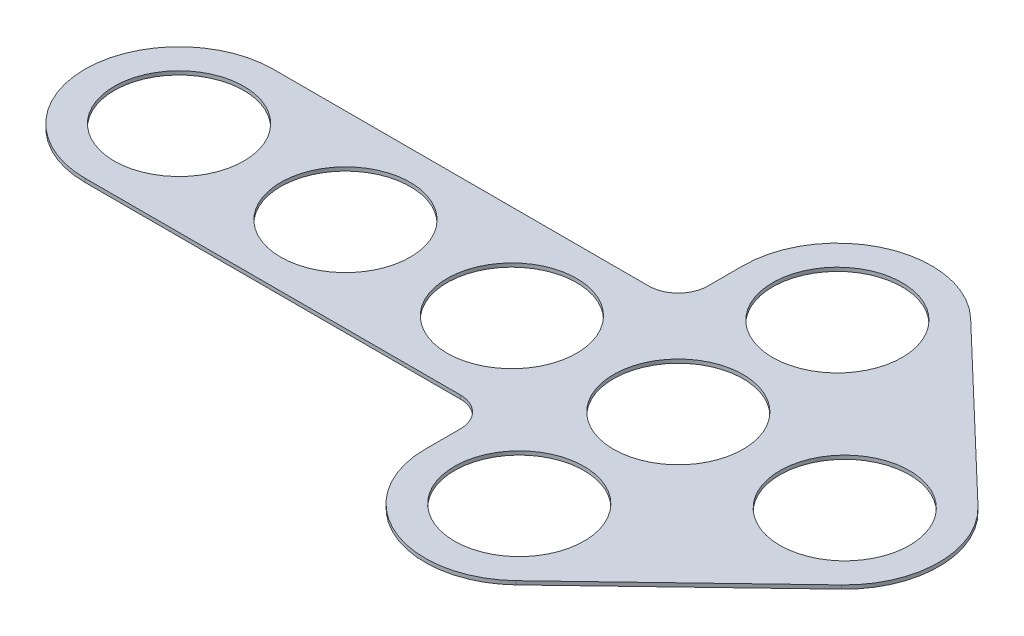
from build123d import *

# Parameters (mm, degrees)
SKETCH1_R           = 55.88
BOSS_EXTRUDE1_DEPTH = 3.175
FILLET1_R           = 25.4


with BuildPart() as part:
    # Sketch1 → Boss-Extrude1 (new body)
    with BuildSketch(Plane(origin=(0, 0, 0), x_dir=(1, 0, 0), z_dir=(0, 1, 0))):
        with BuildLine():
            Line((87.63, 309.88), (436.88, 309.88))
            Line((436.88, 309.88), (436.88, 365.76))
            ThreePointArc((436.88, 365.76), (486.208175566, 440.496331963), (574.318959531, 424.518911361))
            Line((574.318959531, 424.518911361), (717.828959531, 287.358911361))
            ThreePointArc((717.828959531, 287.358911361), (742.95, 228.6), (717.828959531, 169.841088639))
            Line((717.828959531, 169.841088639), (574.318959531, 32.681088639))
            ThreePointArc((574.318959531, 32.681088639), (486.208175566, 16.703668037), (436.88, 91.44))
            Line((436.88, 91.44), (436.88, 147.32))
            Line((436.88, 147.32), (87.63, 147.32))
            ThreePointArc((87.63, 147.32), (6.35, 228.6), (87.63, 309.88))
        make_face()
        with Locations(Location((87.63, 228.6, 0), (0, 0, 270))):
            Circle(SKETCH1_R, mode=Mode.SUBTRACT)
        with Locations(Location((231.14, 228.6, 0), (0, 0, 270))):
            Circle(SKETCH1_R, mode=Mode.SUBTRACT)
        with Locations(Location((374.65, 228.6, 0), (0, 0, 270))):
            Circle(SKETCH1_R, mode=Mode.SUBTRACT)
        with Locations(Location((518.16, 228.6, 0), (0, 0, 270))):
            Circle(SKETCH1_R, mode=Mode.SUBTRACT)
        with Locations(Location((661.67, 228.6, 0), (0, 0, 270))):
            Circle(SKETCH1_R, mode=Mode.SUBTRACT)
        with Locations(Location((518.16, 365.76, 0), (0, 0, 270))):
            Circle(SKETCH1_R, mode=Mode.SUBTRACT)
        with Locations(Location((518.16, 91.44, 0), (0, 0, 270))):
            Circle(SKETCH1_R, mode=Mode.SUBTRACT)
    extrude(amount=BOSS_EXTRUDE1_DEPTH)

    # Fillet1
    fillet1_edges = [part.edges().sort_by_distance(p)[0] for p in [
        (436.88, 1.5875, -147.32),
        (436.88, 1.5875, -309.88),
    ]]
    fillet(fillet1_edges, radius=FILLET1_R)


solid = part.part
